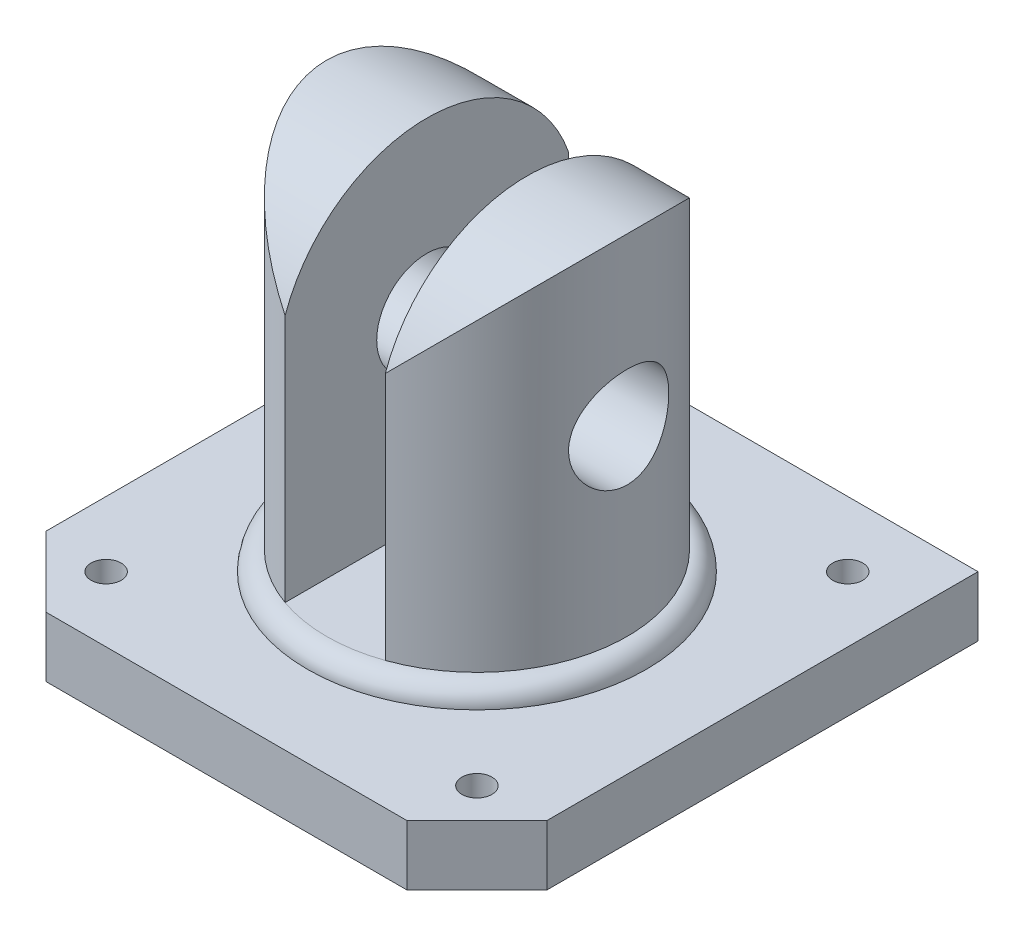
from build123d import *

# Parameters (mm, degrees)
SKETCH1_W               = 50
SKETCH1_H               = 50
BOSS_EXTRUDE1_DEPTH     = 6
SKETCH2_R               = 15
BOSS_EXTRUDE2_DEPTH     = 36.7
CHAMFER1_SIZE           = 7
CUT_EXTRUDE1_DEPTH      = 36.7
CUT_EXTRUDE1_DEPTH_BACK = 36.7
SKETCH3_W               = 10
SKETCH3_H               = 35.728035611
CUT_EXTRUDE2_DEPTH      = 36.7
CUT_EXTRUDE2_DEPTH_BACK = 36.7
CUT_EXTRUDE3_DEPTH      = 36.7
CUT_EXTRUDE3_DEPTH_BACK = 36.7
SKETCH5_R               = 5
SKETCH7_R               = 1.5
CUT_EXTRUDE4_DEPTH      = 9
CHAMFER2_SIZE           = 7


with BuildPart() as part:
    # Sketch1 → Boss-Extrude1 (new body)
    with BuildSketch(Plane(origin=(0, 0, 0), x_dir=(1, 0, 0), z_dir=(0, 1, 0))):
        Rectangle(SKETCH1_W, SKETCH1_H)
    extrude(amount=BOSS_EXTRUDE1_DEPTH)

    # Sketch2 → Boss-Extrude2 (add)
    with BuildSketch(Plane(origin=(0, 6, 0), x_dir=(1, 0, 0), z_dir=(0, 1, 0))):
        with Locations(Location((0, 0, 0), (0, 0, 270))):
            Circle(SKETCH2_R)
    extrude(amount=BOSS_EXTRUDE2_DEPTH)

    # Chamfer1
    chamfer1_edges = [part.edges().sort_by_distance(p)[0] for p in [
        (25, 3, 25),
    ]]
    chamfer(chamfer1_edges, length=CHAMFER1_SIZE)

    # Sketch3 → Cut-Extrude1 (cut, two sides: drawn at the far end of the back side and taken through both)
    with BuildSketch(Plane.XY.offset(-CUT_EXTRUDE1_DEPTH_BACK)):
        with Locations((0, 25.764017805)):
            Rectangle(SKETCH3_W, SKETCH3_H)
    extrude(amount=CUT_EXTRUDE1_DEPTH + CUT_EXTRUDE1_DEPTH_BACK, mode=Mode.SUBTRACT)

    # Sketch4 → Cut-Extrude2 (cut, two sides: drawn at the far end of the back side and taken through both)
    with BuildSketch(Plane(origin=(0, 0, 0), x_dir=(0, 0, -1), z_dir=(1, 0, 0)).offset(-CUT_EXTRUDE2_DEPTH_BACK)):
        with BuildLine():
            Line((-14.375997607, 31.981435834), (-17.281195567, 49.289848302))
            Line((-17.281195567, 49.289848302), (26.224300548, 49.289848302))
            Line((26.224300548, 49.289848302), (14.47548732, 31.631954585))
            ThreePointArc((14.47548732, 31.631954585), (0.181683341, 42.698899665), (-14.375997607, 31.981435834))
        make_face()
    extrude(amount=CUT_EXTRUDE2_DEPTH + CUT_EXTRUDE2_DEPTH_BACK, mode=Mode.SUBTRACT)

    # Sketch5 → Cut-Extrude3 (cut, two sides: drawn at the far end of the back side and taken through both)
    with BuildSketch(Plane(origin=(0, 0, 0), x_dir=(0, 0, -1), z_dir=(1, 0, 0)).offset(-CUT_EXTRUDE3_DEPTH_BACK)):
        with Locations(Location((0, 26, 0), (0, 0, 180))):
            Circle(SKETCH5_R)
    extrude(amount=CUT_EXTRUDE3_DEPTH + CUT_EXTRUDE3_DEPTH_BACK, mode=Mode.SUBTRACT)

    # Sketch6 → Revolve1 (revolve)
    with BuildSketch(Plane(origin=(0, 0, 0), x_dir=(0, 0, -1), z_dir=(1, 0, 0))):
        with BuildLine():
            Line((-15, 7.9), (-15, 6))
            Line((-15, 6), (-16.9, 6))
            ThreePointArc((-16.9, 6), (-16.343502884, 7.343502884), (-15, 7.9))
        make_face()
    revolve(axis=Axis((0, 42.7, 0), (0, -1, 0)))

    # Sketch7 → Cut-Extrude4 (cut)
    with BuildSketch(Plane(origin=(0, 6, 0), x_dir=(1, 0, 0), z_dir=(0, 1, 0))):
        with Locations(Location((-18.5, 18.5, 0), (0, 0, 270))):
            Circle(SKETCH7_R)
        with Locations(Location((18.5, 18.5, 0), (0, 0, 270))):
            Circle(SKETCH7_R)
        with Locations(Location((18.5, -18.5, 0), (0, 0, 270))):
            Circle(SKETCH7_R)
        with Locations(Location((-18.5, -18.5, 0), (0, 0, 270))):
            Circle(SKETCH7_R)
    extrude(amount=-CUT_EXTRUDE4_DEPTH, mode=Mode.SUBTRACT)

    # Chamfer2
    chamfer2_edges = [part.edges().sort_by_distance(p)[0] for p in [
        (-25, 3, 25),
    ]]
    chamfer(chamfer2_edges, length=CHAMFER2_SIZE)


solid = part.part
